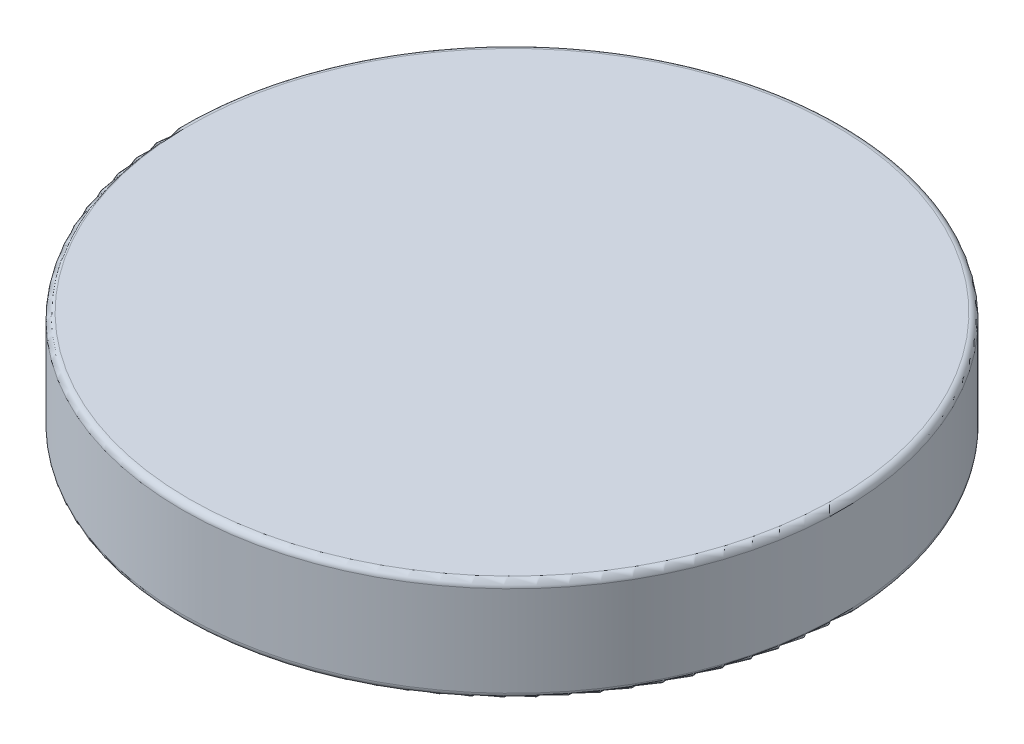
from build123d import *

# Parameters (mm, degrees)
SKETCH2_R           = 64.77
BOSS_EXTRUDE1_DEPTH = 20.32
FILLET1_R           = 1.27


with BuildPart() as part:
    # Sketch2 → Boss-Extrude1 (new body)
    with BuildSketch(Plane(origin=(0, 0, 0), x_dir=(1, 0, 0), z_dir=(0, 1, 0))):
        with Locations(Location((0, 0, 0), (0, 0, 270))):
            Circle(SKETCH2_R)
    extrude(amount=-BOSS_EXTRUDE1_DEPTH)

    # Fillet1
    fillet1_edges = [part.edges().sort_by_distance(p)[0] for p in [
        (0, 0, -64.77),
        (0, -20.32, -64.77),
    ]]
    fillet(fillet1_edges, radius=FILLET1_R)


solid = part.part
